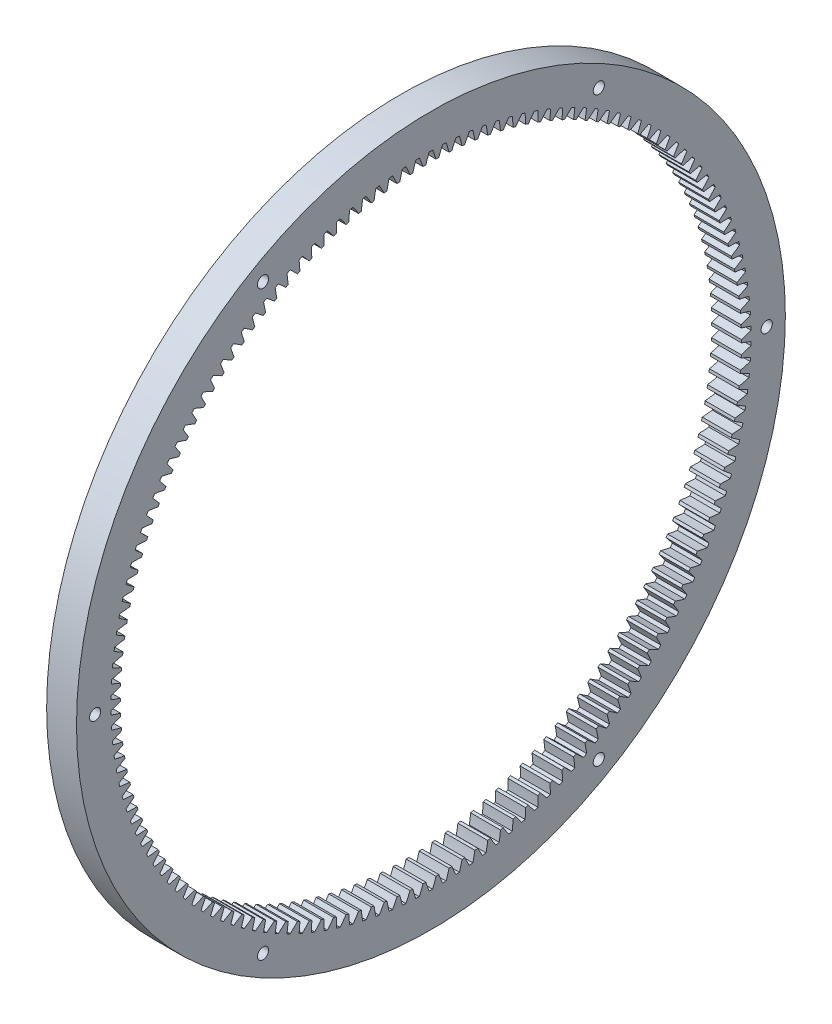
from build123d import *

# Parameters (mm, degrees)
ESBO_O1_R                = 95
ESBO_O1_R_2              = 1.5
RESSALTO_EXTRUS_O1_DEPTH = 8


with BuildPart() as part:
    # Esboço1 → Ressalto-extrusão1 (new body)
    with BuildSketch(Plane(origin=(12, 0, 0), x_dir=(0, 0, -1), z_dir=(1, 0, 0))):
        with Locations(Location((0, 0, 0), (0, 0, 180))):
            Circle(ESBO_O1_R)
        with Locations(Location((-45, 77.942286341, 0), (0, 0, 180))):
            Circle(ESBO_O1_R_2, mode=Mode.SUBTRACT)
        with Locations(Location((-90, 0, 0), (0, 0, 180))):
            Circle(ESBO_O1_R_2, mode=Mode.SUBTRACT)
        with Locations(Location((-45, -77.942286341, 0), (0, 0, 180))):
            Circle(ESBO_O1_R_2, mode=Mode.SUBTRACT)
        with Locations(Location((45, -77.942286341, 0), (0, 0, 180))):
            Circle(ESBO_O1_R_2, mode=Mode.SUBTRACT)
        with Locations(Location((90, 0, 0), (0, 0, 180))):
            Circle(ESBO_O1_R_2, mode=Mode.SUBTRACT)
        with Locations(Location((45, 77.942286341, 0), (0, 0, 180))):
            Circle(ESBO_O1_R_2, mode=Mode.SUBTRACT)
        with BuildLine():
            ThreePointArc((2.124504253, 83.222887367), (2.602984617, 84.482122975), (3.12142424, 85.725440365))
            ThreePointArc((3.12142424, 85.725440365), (3.592187797, 85.707004392), (4.062843003, 85.685983228))
            ThreePointArc((4.062843003, 85.685983228), (4.475426267, 84.403644418), (4.846858413, 83.108786921))
            ThreePointArc((4.846858413, 83.108786921), (5.227310751, 83.085725142), (5.607653516, 83.060921751))
            ThreePointArc((5.607653516, 83.060921751), (6.138445485, 84.299016117), (6.708495077, 85.519532908))
            ThreePointArc((6.708495077, 85.519532908), (7.178073676, 85.481399575), (7.647435762, 85.440687856))
            ThreePointArc((7.647435762, 85.440687856), (8.005958345, 84.142196681), (8.322841678, 82.83292103))
            ThreePointArc((8.322841678, 82.83292103), (8.701994567, 82.793947789), (9.080965049, 82.753239053))
            ThreePointArc((9.080965049, 82.753239053), (9.663137434, 83.96802014), (10.283796934, 85.163595131))
            ThreePointArc((10.283796934, 85.163595131), (10.751366775, 85.105831337), (11.218612321, 85.045500484))
            ThreePointArc((11.218612321, 85.045500484), (11.522445252, 83.733134939), (11.78422385, 82.411738049))
            ThreePointArc((11.78422385, 82.411738049), (12.161412128, 82.356921719), (12.538345483, 82.300379055))
            ThreePointArc((12.538345483, 82.300379055), (13.170876956, 83.489715723), (13.841057517, 84.658251469))
            ThreePointArc((13.841057517, 84.658251469), (14.305798323, 84.580958551), (14.770107621, 84.501114406))
            ThreePointArc((14.770107621, 84.501114406), (15.018717874, 83.177176826), (15.224932489, 81.845976875))
            ThreePointArc((15.224932489, 81.845976875), (15.599494439, 81.775413623), (15.973729399, 81.703136226))
            ThreePointArc((15.973729399, 81.703136226), (16.655510285, 82.864941974), (17.374036182, 84.004388468))
            ThreePointArc((17.374036182, 84.004388468), (17.83513264, 83.907702023), (18.295691134, 83.80848466))
            ThreePointArc((18.295691134, 83.80848466), (18.488642562, 82.475297681), (18.638931423, 81.136630047))
            ThreePointArc((18.638931423, 81.136630047), (19.010209937, 81.050443664), (19.381089965, 80.962558333))
            ThreePointArc((19.381089965, 80.962558333), (20.110924189, 82.09479496), (20.876534884, 83.203153223))
            ThreePointArc((20.876534884, 83.203153223), (21.333178073, 83.087242874), (21.789177788, 82.968826353))
            ThreePointArc((21.789177788, 82.968826353), (21.926131888, 81.628728838), (22.020231338, 80.284941999))
            ThreePointArc((22.020231338, 80.284941999), (22.387575066, 80.183283686), (22.754449514, 80.079944601))
            ThreePointArc((22.754449514, 80.079944601), (23.531056698, 81.180625779), (24.342409049, 82.255951376))
            ThreePointArc((24.342409049, 82.255951376), (24.793797863, 82.121020467), (25.244438819, 81.983612532))
            ThreePointArc((25.244438819, 81.983612532), (25.325155328, 80.638955468), (25.362900285, 79.292406882))
            ThreePointArc((25.362900285, 79.292406882), (25.725664782, 79.175454982), (26.087890027, 79.056843435))
            ThreePointArc((26.087890027, 79.056843435), (26.909907738, 80.124038196), (27.765578357, 81.164444639))
            ThreePointArc((27.765578357, 81.164444639), (28.210920907, 81.010729886), (28.655412527, 80.854571596))
            ThreePointArc((28.655412527, 80.854571596), (28.67974984, 79.507713968), (28.661074086, 78.160765939))
            ThreePointArc((28.661074086, 78.160765939), (29.01862294, 78.028725625), (29.375563515, 77.895049702))
            ThreePointArc((29.375563515, 77.895049702), (30.241549656, 78.926885823), (31.140037407, 79.930547886))
            ThreePointArc((31.140037407, 79.930547886), (31.57855241, 79.758318957), (32.016114905, 79.583684267))
            ThreePointArc((32.016114905, 79.583684267), (31.984030326, 78.236988921), (31.908966624, 76.892004454))
            ThreePointArc((31.908966624, 76.892004454), (32.260672572, 76.74510737), (32.611702284, 76.596601584))
            ThreePointArc((32.611702284, 76.596601584), (33.52013762, 77.591268872), (34.459866249, 78.556425792))
            ThreePointArc((34.459866249, 78.556425792), (34.8907844, 78.365984834), (35.320650137, 78.173180113))
            ThreePointArc((35.320650137, 78.173180113), (35.232199954, 76.82900961), (35.100879992, 75.488348265))
            ThreePointArc((35.100879992, 75.488348265), (35.446126023, 75.326852118), (35.790629045, 75.163776998))
            ThreePointArc((35.790629045, 75.163776998), (36.739919872, 76.119530471), (37.719240776, 77.044489033))
            ThreePointArc((37.719240776, 77.044489033), (38.1418061, 76.836170145), (38.563220947, 76.625533638))
            ThreePointArc((38.563220947, 76.625533638), (38.418560331, 75.28624611), (38.231214489, 73.952259862))
            ThreePointArc((38.231214489, 73.952259862), (38.569394924, 73.776447971), (38.906766881, 73.599089606))
            ThreePointArc((38.906766881, 73.599089606), (39.89524782, 74.514252547), (40.912442938, 75.39739006))
            ThreePointArc((40.912442938, 75.39739006), (41.32591411, 75.171558704), (41.738138764, 74.943459939))
            ThreePointArc((41.738138764, 74.943459939), (41.537521499, 73.611404952), (41.294478445, 72.286434066))
            ThreePointArc((41.294478445, 72.286434066), (41.625, 72.096614865), (41.954649027, 71.905284402))
            ThreePointArc((41.954649027, 71.905284402), (42.980585947, 72.778251305), (44.033870773, 73.618018446))
            ThreePointArc((44.033870773, 73.618018446), (44.437522425, 73.375070806), (44.839833702, 73.129909945))
            ThreePointArc((44.839833702, 73.129909945), (44.58361174, 71.807424376), (44.285297854, 70.493793301))
            ThreePointArc((44.285297854, 70.493793301), (44.607580682, 70.290299798), (44.928928463, 70.085332896))
            ThreePointArc((44.928928463, 70.085332896), (45.990521521, 70.914572279), (47.078048235, 71.709495811))
            ThreePointArc((47.078048235, 71.709495811), (47.471172225, 71.449858101), (47.862864336, 71.18806524))
            ThreePointArc((47.862864336, 71.18806524), (47.551487176, 69.877469177), (47.198425802, 68.577482469))
            ThreePointArc((47.198425802, 68.577482469), (47.51190451, 68.36067166), (47.824387291, 68.142427901))
            ThreePointArc((47.824387291, 68.142427901), (48.919774093, 68.926484997), (50.039634804, 69.675170353))
            ThreePointArc((50.039634804, 69.675170353), (50.421541458, 69.399298066), (50.801927242, 69.121332478))
            ThreePointArc((50.801927242, 69.121332478), (50.435941146, 67.824925153), (50.028751673, 66.54086343))
            ThreePointArc((50.028751673, 66.54086343), (50.332876312, 66.311115676), (50.635945893, 66.079977932))
            ThreePointArc((50.635945893, 66.079977932), (51.763204758, 66.817477238), (52.91343485, 67.518610971))
            ThreePointArc((52.91343485, 67.518610971), (53.283454175, 67.22698808), (53.651866304, 66.933337412))
            ThreePointArc((53.651866304, 66.933337412), (53.231913336, 65.653393163), (52.771310114, 64.387509106))
            ThreePointArc((52.771310114, 64.387509106), (53.065547147, 64.145227461), (53.35867184, 63.901601228))
            ThreePointArc((53.35867184, 63.901601228), (54.515825173, 64.59124892), (55.69440675, 65.243601003))
            ThreePointArc((55.69440675, 65.243601003), (56.051889607, 64.936739113), (56.407681763, 64.627918528))
            ThreePointArc((56.407681763, 64.627918528), (55.934498662, 63.366682813), (55.421289745, 62.121197212))
            ThreePointArc((55.421289745, 62.121197212), (55.705122979, 61.866806721), (55.987788544, 61.611119401))
            ThreePointArc((55.987788544, 61.611119401), (57.172806305, 62.251705603), (58.377671737, 62.854131588))
            ThreePointArc((58.377671737, 62.854131588), (58.721990978, 62.53256904), (59.064538979, 62.209120314))
            ThreePointArc((59.064538979, 62.209120314), (58.538955871, 60.968805768), (57.974041601, 59.745903629))
            ThreePointArc((57.974041601, 59.745903629), (58.246973098, 59.479850579), (58.518683643, 59.212550736))
            ThreePointArc((58.518683643, 59.212550736), (59.729486908, 59.802951641), (60.95852245, 60.354394668))
            ThreePointArc((60.95852245, 60.354394668), (61.289074022, 60.018695592), (61.617776925, 59.681186164))
            ThreePointArc((61.617776925, 59.681186164), (61.040715859, 58.463968721), (60.425087289, 57.265795429))
            ThreePointArc((60.425087289, 57.265795429), (60.686638233, 56.988546569), (60.946917087, 56.710103136))
            ThreePointArc((60.946917087, 56.710103136), (62.181381695, 57.24928298), (63.432431201, 57.748775632))
            ThreePointArc((63.432431201, 57.748775632), (63.748635205, 57.399528957), (64.062916351, 57.048550934))
            ThreePointArc((64.062916351, 57.048550934), (63.43538969, 55.856566007), (62.770126841, 54.685223565))
            ThreePointArc((62.770126841, 54.685223565), (63.019838383, 54.397265282), (63.268228927, 54.108166744))
            ThreePointArc((63.268228927, 54.108166744), (64.524189209, 54.595179624), (65.795057913, 55.04184562))
            ThreePointArc((65.795057913, 55.04184562), (66.09635962, 54.679664045), (66.395667654, 54.31583316))
            ThreePointArc((66.395667654, 54.31583316), (65.718776293, 53.151171896), (65.005046261, 52.008715237))
            ThreePointArc((65.005046261, 52.008715237), (65.242480322, 51.710552708), (65.478546796, 51.411306242))
            ThreePointArc((65.478546796, 51.411306242), (66.75379937, 51.845297771), (68.042257737, 52.238353507))
            ThreePointArc((68.042257737, 52.238353507), (68.32812856, 51.863872421), (68.611938394, 51.487826958))
            ThreePointArc((68.611938394, 51.487826958), (67.88686983, 50.352532568), (67.125924741, 49.240965949))
            ThreePointArc((67.125924741, 49.240965949), (67.350664782, 48.933122253), (67.573993043, 48.62425284))
            ThreePointArc((67.573993043, 48.62425284), (68.866300683, 49.004461649), (70.170088319, 49.343217572))
            ThreePointArc((70.170088319, 49.343217572), (70.440026745, 48.957093941), (70.70784048, 48.569493612))
            ThreePointArc((70.70784048, 48.569493612), (69.935866729, 47.465557788), (69.12904154, 46.386831276))
            ThreePointArc((69.12904154, 46.386831276), (69.340693289, 46.069846475), (69.550891545, 45.751895975))
            ThreePointArc((69.550891545, 45.751895975), (70.857987104, 46.077655049), (72.174816723, 46.361516866))
            ThreePointArc((72.174816723, 46.361516866), (72.428349187, 45.964428084), (72.679696987, 45.56595287))
            ThreePointArc((72.679696987, 45.56595287), (71.862172354, 44.495312291), (71.010882509, 43.451318337))
            ThreePointArc((71.010882509, 43.451318337), (71.209074658, 43.12574853), (71.40577415, 42.799274738))
            ThreePointArc((71.40577415, 42.799274738), (72.725364538, 43.070012585), (74.052925972, 43.298482306))
            ThreePointArc((74.052925972, 43.298482306), (74.289607694, 42.891125), (74.524048608, 42.482473964))
            ThreePointArc((74.524048608, 42.482473964), (73.662407309, 41.447006897), (72.768146261, 40.439577022))
            ThreePointArc((72.768146261, 40.439577022), (72.952531114, 40.105993369), (73.135386763, 39.77156903))
            ThreePointArc((73.135386763, 39.77156903), (74.46515697, 39.986810684), (75.801121227, 40.159487495))
            ThreePointArc((75.801121227, 40.159487495), (76.020536984, 39.742576309), (76.237659725, 39.324466362))
            ThreePointArc((76.237659725, 39.324466362), (75.333413372, 38.325989369), (74.397749958, 37.356890946))
            ThreePointArc((74.397749958, 37.356890946), (74.56800404, 37.015878667), (74.736695056, 36.674090475))
            ThreePointArc((74.736695056, 36.674090475), (76.074312214, 36.833458329), (77.416335557, 36.950039296))
            ThreePointArc((77.416335557, 36.950039296), (77.618100421, 36.524305634), (77.817524081, 36.097470284))
            ThreePointArc((77.817524081, 36.097470284), (76.872259028, 35.137735032), (75.896834721, 34.208668191))
            ThreePointArc((75.896834721, 34.208668191), (76.052659349, 33.860825536), (76.20688979, 33.512273104))
            ThreePointArc((76.20688979, 33.512273104), (77.550007264, 33.615487572), (78.895735328, 33.675768173))
            ThreePointArc((78.895735328, 33.675768173), (79.079495335, 33.241958916), (79.260870058, 32.807146977))
            ThreePointArc((79.260870058, 32.807146977), (78.276244622, 31.887837168), (77.262770645, 31.000431807))
            ThreePointArc((77.262770645, 31.000431807), (77.40389245, 30.646369011), (77.543391744, 30.291663818))
            ThreePointArc((77.543391744, 30.291663818), (78.889653249, 30.338543827), (80.236725171, 30.34241831))
            ThreePointArc((80.236725171, 30.34241831), (80.402157943, 29.901294506), (80.565165535, 29.459268787))
            ThreePointArc((80.565165535, 29.459268787), (79.542907083, 28.581997202), (78.493161416, 27.737810131))
            ThreePointArc((78.493161416, 27.737810131), (78.619332822, 27.378148341), (78.74385624, 27.01791266))
            ThreePointArc((78.74385624, 27.01791266), (80.090899976, 27.008375967), (81.436952533, 26.955837534))
            ThreePointArc((81.436952533, 26.955837534), (81.583767845, 26.508173066), (81.728122335, 26.059709028))
            ThreePointArc((81.728122335, 26.059709028), (80.670024257, 25.2260147), (79.58584851, 24.426526911))
            ThreePointArc((79.58584851, 24.426526911), (79.69684817, 24.061897096), (79.806177254, 23.696762903))
            ThreePointArc((79.806177254, 23.696762903), (81.151640049, 23.630826239), (82.494311808, 23.52196706))
            ThreePointArc((82.494311808, 23.52196706), (82.622252096, 23.068547282), (82.747700238, 22.614431685))
            ThreePointArc((82.747700238, 22.614431685), (81.655618796, 21.825777197), (80.538914982, 21.072391263))
            ThreePointArc((80.538914982, 21.072391263), (80.634548164, 20.703433106), (80.728491115, 20.334040972))
            ThreePointArc((80.728491115, 20.334040972), (82.070012569, 20.211820011), (83.406948028, 20.046831062))
            ThreePointArc((83.406948028, 20.046831062), (83.515788841, 19.588451428), (83.622110556, 19.129480944))
            ThreePointArc((83.622110556, 19.129480944), (82.497961634, 18.387249865), (81.350688829, 17.68128748))
            ThreePointArc((81.350688829, 17.68128748), (81.430787761, 17.308648261), (81.509179771, 16.935646223))
            ThreePointArc((81.509179771, 16.935646223), (82.844406401, 16.757355383), (84.17326012, 16.536526111))
            ThreePointArc((84.17326012, 16.536526111), (84.262810514, 16.073990773), (84.349819278, 15.610970593))
            ThreePointArc((84.349819278, 15.610970593), (83.195575013, 14.916465048), (82.019745926, 14.259164711))
            ThreePointArc((82.019745926, 14.259164711), (82.084170086, 13.883498164), (82.146873629, 13.507540596))
            ThreePointArc((82.146873629, 13.507540596), (83.473462992, 13.273492659), (84.791903711, 12.997210474))
            ThreePointArc((84.791903711, 12.997210474), (84.862006584, 12.531330877), (84.929549754, 12.065073296))
            ThreePointArc((84.929549754, 12.065073296), (83.747235084, 11.419511683), (82.544912517, 10.812026522))
            ThreePointArc((82.544912517, 10.812026522), (82.593548884, 10.433991694), (82.640453957, 10.055738153))
            ThreePointArc((82.640453957, 10.055738153), (83.956078765, 9.766343719), (85.261793491, 9.435093313))
            ThreePointArc((85.261793491, 9.435093313), (85.312325859, 8.966686768), (85.360284941, 8.49800976))
            ThreePointArc((85.360284941, 8.49800976), (84.151974047, 7.902524614), (82.925267283, 7.345920364))
            ThreePointArc((82.925267283, 7.345920364), (82.958030533, 6.966180457), (82.989054847, 6.586294529))
            ThreePointArc((82.989054847, 6.586294529), (84.291407048, 6.242061294), (85.582105112, 5.856423793))
            ThreePointArc((85.582105112, 5.856423793), (85.612978325, 5.386312044), (85.641269182, 4.916037827))
            ThreePointArc((85.641269182, 4.916037827), (84.409081853, 4.371673831), (83.160142952, 3.866926965))
            ThreePointArc((83.160142952, 3.866926965), (83.176975606, 3.486148173), (83.192064735, 3.105296305))
            ThreePointArc((83.192064735, 3.105296305), (84.47885956, 2.706828171), (85.75227664, 2.267480115))
            ThreePointArc((85.75227664, 2.267480115), (85.763436535, 1.796487898), (85.772009536, 1.325441493))
            ThreePointArc((85.772009536, 1.325441493), (84.518107446, 0.833153647), (83.249127472, 0.381149663))
            ThreePointArc((83.249127472, 0.381149663), (83.25, 0), (83.249127472, -0.381149663))
            ThreePointArc((83.249127472, -0.381149663), (84.518107446, -0.833153647), (85.772009536, -1.325441493))
            ThreePointArc((85.772009536, -1.325441493), (85.763436535, -1.796487898), (85.75227664, -2.267480115))
            ThreePointArc((85.75227664, -2.267480115), (84.47885956, -2.706828171), (83.192064735, -3.105296305))
            ThreePointArc((83.192064735, -3.105296305), (83.176975606, -3.486148173), (83.160142952, -3.866926965))
            ThreePointArc((83.160142952, -3.866926965), (84.409081853, -4.371673831), (85.641269182, -4.916037827))
            ThreePointArc((85.641269182, -4.916037827), (85.612978325, -5.386312044), (85.582105112, -5.856423793))
            ThreePointArc((85.582105112, -5.856423793), (84.291407048, -6.242061294), (82.989054847, -6.586294529))
            ThreePointArc((82.989054847, -6.586294529), (82.958030533, -6.966180457), (82.925267283, -7.345920364))
            ThreePointArc((82.925267283, -7.345920364), (84.151974047, -7.902524614), (85.360284941, -8.49800976))
            ThreePointArc((85.360284941, -8.49800976), (85.312325859, -8.966686768), (85.261793491, -9.435093313))
            ThreePointArc((85.261793491, -9.435093313), (83.956078765, -9.766343719), (82.640453957, -10.055738153))
            ThreePointArc((82.640453957, -10.055738153), (82.593548884, -10.433991694), (82.544912517, -10.812026522))
            ThreePointArc((82.544912517, -10.812026522), (83.747235084, -11.419511683), (84.929549754, -12.065073296))
            ThreePointArc((84.929549754, -12.065073296), (84.862006584, -12.531330877), (84.791903711, -12.997210474))
            ThreePointArc((84.791903711, -12.997210474), (83.473462992, -13.273492659), (82.146873629, -13.507540596))
            ThreePointArc((82.146873629, -13.507540596), (82.084170086, -13.883498164), (82.019745926, -14.259164711))
            ThreePointArc((82.019745926, -14.259164711), (83.195575013, -14.916465048), (84.349819278, -15.610970593))
            ThreePointArc((84.349819278, -15.610970593), (84.262810514, -16.073990773), (84.17326012, -16.536526111))
            ThreePointArc((84.17326012, -16.536526111), (82.844406401, -16.757355383), (81.509179771, -16.935646223))
            ThreePointArc((81.509179771, -16.935646223), (81.430787761, -17.308648261), (81.350688829, -17.68128748))
            ThreePointArc((81.350688829, -17.68128748), (82.497961634, -18.387249865), (83.622110556, -19.129480944))
            ThreePointArc((83.622110556, -19.129480944), (83.515788841, -19.588451428), (83.406948028, -20.046831062))
            ThreePointArc((83.406948028, -20.046831062), (82.070012569, -20.211820011), (80.728491115, -20.334040972))
            ThreePointArc((80.728491115, -20.334040972), (80.634548164, -20.703433106), (80.538914982, -21.072391263))
            ThreePointArc((80.538914982, -21.072391263), (81.655618796, -21.825777197), (82.747700238, -22.614431685))
            ThreePointArc((82.747700238, -22.614431685), (82.622252096, -23.068547282), (82.494311808, -23.52196706))
            ThreePointArc((82.494311808, -23.52196706), (81.151640049, -23.630826239), (79.806177254, -23.696762903))
            ThreePointArc((79.806177254, -23.696762903), (79.69684817, -24.061897096), (79.58584851, -24.426526911))
            ThreePointArc((79.58584851, -24.426526911), (80.670024257, -25.2260147), (81.728122335, -26.059709028))
            ThreePointArc((81.728122335, -26.059709028), (81.583767845, -26.508173066), (81.436952533, -26.955837534))
            ThreePointArc((81.436952533, -26.955837534), (80.090899976, -27.008375967), (78.74385624, -27.01791266))
            ThreePointArc((78.74385624, -27.01791266), (78.619332822, -27.378148341), (78.493161416, -27.737810131))
            ThreePointArc((78.493161416, -27.737810131), (79.542907083, -28.581997202), (80.565165535, -29.459268787))
            ThreePointArc((80.565165535, -29.459268787), (80.402157943, -29.901294506), (80.236725171, -30.34241831))
            ThreePointArc((80.236725171, -30.34241831), (78.889653249, -30.338543827), (77.543391744, -30.291663818))
            ThreePointArc((77.543391744, -30.291663818), (77.40389245, -30.646369011), (77.262770645, -31.000431807))
            ThreePointArc((77.262770645, -31.000431807), (78.276244622, -31.887837168), (79.260870058, -32.807146977))
            ThreePointArc((79.260870058, -32.807146977), (79.079495335, -33.241958916), (78.895735328, -33.675768173))
            ThreePointArc((78.895735328, -33.675768173), (77.550007264, -33.615487572), (76.20688979, -33.512273104))
            ThreePointArc((76.20688979, -33.512273104), (76.052659349, -33.860825536), (75.896834721, -34.208668191))
            ThreePointArc((75.896834721, -34.208668191), (76.872259028, -35.137735032), (77.817524081, -36.097470284))
            ThreePointArc((77.817524081, -36.097470284), (77.618100421, -36.524305634), (77.416335557, -36.950039296))
            ThreePointArc((77.416335557, -36.950039296), (76.074312214, -36.833458329), (74.736695056, -36.674090475))
            ThreePointArc((74.736695056, -36.674090475), (74.56800404, -37.015878667), (74.397749958, -37.356890946))
            ThreePointArc((74.397749958, -37.356890946), (75.333413372, -38.325989369), (76.237659725, -39.324466362))
            ThreePointArc((76.237659725, -39.324466362), (76.020536984, -39.742576309), (75.801121227, -40.159487495))
            ThreePointArc((75.801121227, -40.159487495), (74.46515697, -39.986810684), (73.135386763, -39.77156903))
            ThreePointArc((73.135386763, -39.77156903), (72.952531114, -40.105993369), (72.768146261, -40.439577022))
            ThreePointArc((72.768146261, -40.439577022), (73.662407309, -41.447006897), (74.524048608, -42.482473964))
            ThreePointArc((74.524048608, -42.482473964), (74.289607694, -42.891125), (74.052925972, -43.298482306))
            ThreePointArc((74.052925972, -43.298482306), (72.725364538, -43.070012585), (71.40577415, -42.799274738))
            ThreePointArc((71.40577415, -42.799274738), (71.209074658, -43.12574853), (71.010882509, -43.451318337))
            ThreePointArc((71.010882509, -43.451318337), (71.862172354, -44.495312291), (72.679696987, -45.56595287))
            ThreePointArc((72.679696987, -45.56595287), (72.428349187, -45.964428084), (72.174816723, -46.361516866))
            ThreePointArc((72.174816723, -46.361516866), (70.857987104, -46.077655049), (69.550891545, -45.751895975))
            ThreePointArc((69.550891545, -45.751895975), (69.340693289, -46.069846475), (69.12904154, -46.386831276))
            ThreePointArc((69.12904154, -46.386831276), (69.935866729, -47.465557788), (70.70784048, -48.569493612))
            ThreePointArc((70.70784048, -48.569493612), (70.440026745, -48.957093941), (70.170088319, -49.343217572))
            ThreePointArc((70.170088319, -49.343217572), (68.866300683, -49.004461649), (67.573993043, -48.62425284))
            ThreePointArc((67.573993043, -48.62425284), (67.350664782, -48.933122253), (67.125924741, -49.240965949))
            ThreePointArc((67.125924741, -49.240965949), (67.88686983, -50.352532568), (68.611938394, -51.487826958))
            ThreePointArc((68.611938394, -51.487826958), (68.32812856, -51.863872421), (68.042257737, -52.238353507))
            ThreePointArc((68.042257737, -52.238353507), (66.75379937, -51.845297771), (65.478546796, -51.411306242))
            ThreePointArc((65.478546796, -51.411306242), (65.242480322, -51.710552708), (65.005046261, -52.008715237))
            ThreePointArc((65.005046261, -52.008715237), (65.718776293, -53.151171896), (66.395667654, -54.31583316))
            ThreePointArc((66.395667654, -54.31583316), (66.09635962, -54.679664045), (65.795057913, -55.04184562))
            ThreePointArc((65.795057913, -55.04184562), (64.524189209, -54.595179624), (63.268228927, -54.108166744))
            ThreePointArc((63.268228927, -54.108166744), (63.019838383, -54.397265282), (62.770126841, -54.685223565))
            ThreePointArc((62.770126841, -54.685223565), (63.43538969, -55.856566007), (64.062916351, -57.048550934))
            ThreePointArc((64.062916351, -57.048550934), (63.748635205, -57.399528957), (63.432431201, -57.748775632))
            ThreePointArc((63.432431201, -57.748775632), (62.181381695, -57.24928298), (60.946917087, -56.710103136))
            ThreePointArc((60.946917087, -56.710103136), (60.686638233, -56.988546569), (60.425087289, -57.265795429))
            ThreePointArc((60.425087289, -57.265795429), (61.040715859, -58.463968721), (61.617776925, -59.681186164))
            ThreePointArc((61.617776925, -59.681186164), (61.289074022, -60.018695592), (60.95852245, -60.354394668))
            ThreePointArc((60.95852245, -60.354394668), (59.729486908, -59.802951641), (58.518683643, -59.212550736))
            ThreePointArc((58.518683643, -59.212550736), (58.246973098, -59.479850579), (57.974041601, -59.745903629))
            ThreePointArc((57.974041601, -59.745903629), (58.538955871, -60.968805768), (59.064538979, -62.209120314))
            ThreePointArc((59.064538979, -62.209120314), (58.721990978, -62.53256904), (58.377671737, -62.854131588))
            ThreePointArc((58.377671737, -62.854131588), (57.172806305, -62.251705603), (55.987788544, -61.611119401))
            ThreePointArc((55.987788544, -61.611119401), (55.705122979, -61.866806721), (55.421289745, -62.121197212))
            ThreePointArc((55.421289745, -62.121197212), (55.934498662, -63.366682813), (56.407681763, -64.627918528))
            ThreePointArc((56.407681763, -64.627918528), (56.051889607, -64.936739113), (55.69440675, -65.243601003))
            ThreePointArc((55.69440675, -65.243601003), (54.515825173, -64.59124892), (53.35867184, -63.901601228))
            ThreePointArc((53.35867184, -63.901601228), (53.065547147, -64.145227461), (52.771310114, -64.387509106))
            ThreePointArc((52.771310114, -64.387509106), (53.231913336, -65.653393163), (53.651866304, -66.933337412))
            ThreePointArc((53.651866304, -66.933337412), (53.283454175, -67.22698808), (52.91343485, -67.518610971))
            ThreePointArc((52.91343485, -67.518610971), (51.763204758, -66.817477238), (50.635945893, -66.079977932))
            ThreePointArc((50.635945893, -66.079977932), (50.332876312, -66.311115676), (50.028751673, -66.54086343))
            ThreePointArc((50.028751673, -66.54086343), (50.435941146, -67.824925153), (50.801927242, -69.121332478))
            ThreePointArc((50.801927242, -69.121332478), (50.421541458, -69.399298066), (50.039634804, -69.675170353))
            ThreePointArc((50.039634804, -69.675170353), (48.919774093, -68.926484997), (47.824387291, -68.142427901))
            ThreePointArc((47.824387291, -68.142427901), (47.51190451, -68.36067166), (47.198425802, -68.577482469))
            ThreePointArc((47.198425802, -68.577482469), (47.551487176, -69.877469177), (47.862864336, -71.18806524))
            ThreePointArc((47.862864336, -71.18806524), (47.471172225, -71.449858101), (47.078048235, -71.709495811))
            ThreePointArc((47.078048235, -71.709495811), (45.990521521, -70.914572279), (44.928928463, -70.085332896))
            ThreePointArc((44.928928463, -70.085332896), (44.607580682, -70.290299798), (44.285297854, -70.493793301))
            ThreePointArc((44.285297854, -70.493793301), (44.58361174, -71.807424376), (44.839833702, -73.129909945))
            ThreePointArc((44.839833702, -73.129909945), (44.437522425, -73.375070806), (44.033870773, -73.618018446))
            ThreePointArc((44.033870773, -73.618018446), (42.980585947, -72.778251305), (41.954649027, -71.905284402))
            ThreePointArc((41.954649027, -71.905284402), (41.625, -72.096614865), (41.294478445, -72.286434066))
            ThreePointArc((41.294478445, -72.286434066), (41.537521499, -73.611404952), (41.738138764, -74.943459939))
            ThreePointArc((41.738138764, -74.943459939), (41.32591411, -75.171558704), (40.912442938, -75.39739006))
            ThreePointArc((40.912442938, -75.39739006), (39.89524782, -74.514252547), (38.906766881, -73.599089606))
            ThreePointArc((38.906766881, -73.599089606), (38.569394924, -73.776447971), (38.231214489, -73.952259862))
            ThreePointArc((38.231214489, -73.952259862), (38.418560331, -75.28624611), (38.563220947, -76.625533638))
            ThreePointArc((38.563220947, -76.625533638), (38.1418061, -76.836170145), (37.719240776, -77.044489033))
            ThreePointArc((37.719240776, -77.044489033), (36.739919872, -76.119530471), (35.790629045, -75.163776998))
            ThreePointArc((35.790629045, -75.163776998), (35.446126023, -75.326852118), (35.100879992, -75.488348265))
            ThreePointArc((35.100879992, -75.488348265), (35.232199954, -76.82900961), (35.320650137, -78.173180113))
            ThreePointArc((35.320650137, -78.173180113), (34.8907844, -78.365984834), (34.459866249, -78.556425792))
            ThreePointArc((34.459866249, -78.556425792), (33.52013762, -77.591268872), (32.611702284, -76.596601584))
            ThreePointArc((32.611702284, -76.596601584), (32.260672572, -76.74510737), (31.908966624, -76.892004454))
            ThreePointArc((31.908966624, -76.892004454), (31.984030326, -78.236988921), (32.016114905, -79.583684267))
            ThreePointArc((32.016114905, -79.583684267), (31.57855241, -79.758318957), (31.140037407, -79.930547886))
            ThreePointArc((31.140037407, -79.930547886), (30.241549656, -78.926885823), (29.375563515, -77.895049702))
            ThreePointArc((29.375563515, -77.895049702), (29.01862294, -78.028725625), (28.661074086, -78.160765939))
            ThreePointArc((28.661074086, -78.160765939), (28.67974984, -79.507713968), (28.655412527, -80.854571596))
            ThreePointArc((28.655412527, -80.854571596), (28.210920907, -81.010729886), (27.765578357, -81.164444639))
            ThreePointArc((27.765578357, -81.164444639), (26.909907738, -80.124038196), (26.087890027, -79.056843435))
            ThreePointArc((26.087890027, -79.056843435), (25.725664782, -79.175454982), (25.362900285, -79.292406882))
            ThreePointArc((25.362900285, -79.292406882), (25.325155328, -80.638955468), (25.244438819, -81.983612532))
            ThreePointArc((25.244438819, -81.983612532), (24.793797863, -82.121020467), (24.342409049, -82.255951376))
            ThreePointArc((24.342409049, -82.255951376), (23.531056699, -81.180625779), (22.754449514, -80.079944601))
            ThreePointArc((22.754449514, -80.079944601), (22.387575066, -80.183283686), (22.020231338, -80.284941999))
            ThreePointArc((22.020231338, -80.284941999), (21.926131888, -81.628728838), (21.789177788, -82.968826353))
            ThreePointArc((21.789177788, -82.968826353), (21.333178073, -83.087242874), (20.876534884, -83.203153223))
            ThreePointArc((20.876534884, -83.203153223), (20.110924189, -82.09479496), (19.381089965, -80.962558333))
            ThreePointArc((19.381089965, -80.962558333), (19.010209937, -81.050443664), (18.638931423, -81.136630047))
            ThreePointArc((18.638931423, -81.136630047), (18.488642562, -82.475297681), (18.295691134, -83.80848466))
            ThreePointArc((18.295691134, -83.80848466), (17.83513264, -83.907702023), (17.374036182, -84.004388468))
            ThreePointArc((17.374036182, -84.004388468), (16.655510285, -82.864941974), (15.973729399, -81.703136226))
            ThreePointArc((15.973729399, -81.703136226), (15.599494439, -81.775413623), (15.224932489, -81.845976875))
            ThreePointArc((15.224932489, -81.845976875), (15.018717874, -83.177176826), (14.770107621, -84.501114406))
            ThreePointArc((14.770107621, -84.501114406), (14.305798323, -84.580958551), (13.841057517, -84.658251469))
            ThreePointArc((13.841057517, -84.658251469), (13.170876956, -83.489715723), (12.538345483, -82.300379055))
            ThreePointArc((12.538345483, -82.300379055), (12.161412128, -82.356921719), (11.78422385, -82.411738049))
            ThreePointArc((11.78422385, -82.411738049), (11.522445252, -83.733134939), (11.218612321, -85.045500484))
            ThreePointArc((11.218612321, -85.045500484), (10.751366775, -85.105831337), (10.283796934, -85.163595131))
            ThreePointArc((10.283796934, -85.163595131), (9.663137434, -83.96802014), (9.080965049, -82.753239053))
            ThreePointArc((9.080965049, -82.753239053), (8.701994567, -82.793947789), (8.322841678, -82.83292103))
            ThreePointArc((8.322841678, -82.83292103), (8.005958345, -84.142196681), (7.647435762, -85.440687856))
            ThreePointArc((7.647435762, -85.440687856), (7.178073676, -85.481399575), (6.708495077, -85.519532908))
            ThreePointArc((6.708495077, -85.519532908), (6.138445485, -84.299016117), (5.607653516, -83.060921751))
            ThreePointArc((5.607653516, -83.060921751), (5.227310751, -83.085725142), (4.846858413, -83.108786921))
            ThreePointArc((4.846858413, -83.108786921), (4.475426267, -84.403644418), (4.062843003, -85.685983228))
            ThreePointArc((4.062843003, -85.685983228), (3.592187797, -85.707004392), (3.12142424, -85.725440365))
            ThreePointArc((3.12142424, -85.725440365), (2.602984617, -84.482122975), (2.124504253, -83.222887367))
            ThreePointArc((2.124504253, -83.222887367), (1.743456455, -83.231741899), (1.362372112, -83.238851759))
            ThreePointArc((1.362372112, -83.238851759), (0.937042771, -84.517019482), (0.471122636, -85.78095627))
            ThreePointArc((0.471122636, -85.78095627), (0, -85.78225), (-0.471122636, -85.78095627))
            ThreePointArc((-0.471122636, -85.78095627), (-0.937042771, -84.517019482), (-1.362372112, -83.238851759))
            ThreePointArc((-1.362372112, -83.238851759), (-1.743456455, -83.231741899), (-2.124504253, -83.222887367))
            ThreePointArc((-2.124504253, -83.222887367), (-2.602984617, -84.482122975), (-3.12142424, -85.725440365))
            ThreePointArc((-3.12142424, -85.725440365), (-3.592187797, -85.707004392), (-4.062843003, -85.685983228))
            ThreePointArc((-4.062843003, -85.685983228), (-4.475426267, -84.403644418), (-4.846858413, -83.108786921))
            ThreePointArc((-4.846858413, -83.108786921), (-5.227310751, -83.085725142), (-5.607653516, -83.060921751))
            ThreePointArc((-5.607653516, -83.060921751), (-6.138445485, -84.299016117), (-6.708495077, -85.519532908))
            ThreePointArc((-6.708495077, -85.519532908), (-7.178073676, -85.481399575), (-7.647435762, -85.440687856))
            ThreePointArc((-7.647435762, -85.440687856), (-8.005958345, -84.142196681), (-8.322841678, -82.83292103))
            ThreePointArc((-8.322841678, -82.83292103), (-8.701994567, -82.793947789), (-9.080965049, -82.753239053))
            ThreePointArc((-9.080965049, -82.753239053), (-9.663137434, -83.96802014), (-10.283796934, -85.163595131))
            ThreePointArc((-10.283796934, -85.163595131), (-10.751366775, -85.105831337), (-11.218612321, -85.045500484))
            ThreePointArc((-11.218612321, -85.045500484), (-11.522445252, -83.733134939), (-11.78422385, -82.411738049))
            ThreePointArc((-11.78422385, -82.411738049), (-12.161412128, -82.356921719), (-12.538345483, -82.300379055))
            ThreePointArc((-12.538345483, -82.300379055), (-13.170876956, -83.489715723), (-13.841057517, -84.658251469))
            ThreePointArc((-13.841057517, -84.658251469), (-14.305798323, -84.580958551), (-14.770107621, -84.501114406))
            ThreePointArc((-14.770107621, -84.501114406), (-15.018717874, -83.177176826), (-15.224932489, -81.845976875))
            ThreePointArc((-15.224932489, -81.845976875), (-15.599494439, -81.775413623), (-15.973729399, -81.703136226))
            ThreePointArc((-15.973729399, -81.703136226), (-16.655510285, -82.864941974), (-17.374036182, -84.004388468))
            ThreePointArc((-17.374036182, -84.004388468), (-17.83513264, -83.907702023), (-18.295691134, -83.80848466))
            ThreePointArc((-18.295691134, -83.80848466), (-18.488642562, -82.475297681), (-18.638931423, -81.136630047))
            ThreePointArc((-18.638931423, -81.136630047), (-19.010209937, -81.050443664), (-19.381089965, -80.962558333))
            ThreePointArc((-19.381089965, -80.962558333), (-20.110924189, -82.09479496), (-20.876534884, -83.203153223))
            ThreePointArc((-20.876534884, -83.203153223), (-21.333178073, -83.087242874), (-21.789177788, -82.968826353))
            ThreePointArc((-21.789177788, -82.968826353), (-21.926131888, -81.628728838), (-22.020231338, -80.284941999))
            ThreePointArc((-22.020231338, -80.284941999), (-22.387575066, -80.183283686), (-22.754449514, -80.079944601))
            ThreePointArc((-22.754449514, -80.079944601), (-23.531056698, -81.180625779), (-24.342409049, -82.255951376))
            ThreePointArc((-24.342409049, -82.255951376), (-24.793797863, -82.121020467), (-25.244438819, -81.983612532))
            ThreePointArc((-25.244438819, -81.983612532), (-25.325155328, -80.638955468), (-25.362900285, -79.292406882))
            ThreePointArc((-25.362900285, -79.292406882), (-25.725664782, -79.175454982), (-26.087890027, -79.056843435))
            ThreePointArc((-26.087890027, -79.056843435), (-26.909907738, -80.124038196), (-27.765578357, -81.164444639))
            ThreePointArc((-27.765578357, -81.164444639), (-28.210920907, -81.010729886), (-28.655412527, -80.854571596))
            ThreePointArc((-28.655412527, -80.854571596), (-28.67974984, -79.507713968), (-28.661074086, -78.160765939))
            ThreePointArc((-28.661074086, -78.160765939), (-29.01862294, -78.028725625), (-29.375563515, -77.895049702))
            ThreePointArc((-29.375563515, -77.895049702), (-30.241549656, -78.926885823), (-31.140037407, -79.930547886))
            ThreePointArc((-31.140037407, -79.930547886), (-31.57855241, -79.758318957), (-32.016114905, -79.583684267))
            ThreePointArc((-32.016114905, -79.583684267), (-31.984030326, -78.236988921), (-31.908966624, -76.892004454))
            ThreePointArc((-31.908966624, -76.892004454), (-32.260672572, -76.74510737), (-32.611702284, -76.596601584))
            ThreePointArc((-32.611702284, -76.596601584), (-33.52013762, -77.591268872), (-34.459866249, -78.556425792))
            ThreePointArc((-34.459866249, -78.556425792), (-34.8907844, -78.365984834), (-35.320650137, -78.173180113))
            ThreePointArc((-35.320650137, -78.173180113), (-35.232199954, -76.82900961), (-35.100879992, -75.488348265))
            ThreePointArc((-35.100879992, -75.488348265), (-35.446126023, -75.326852118), (-35.790629045, -75.163776998))
            ThreePointArc((-35.790629045, -75.163776998), (-36.739919872, -76.119530471), (-37.719240776, -77.044489033))
            ThreePointArc((-37.719240776, -77.044489033), (-38.1418061, -76.836170145), (-38.563220947, -76.625533638))
            ThreePointArc((-38.563220947, -76.625533638), (-38.418560331, -75.28624611), (-38.231214489, -73.952259862))
            ThreePointArc((-38.231214489, -73.952259862), (-38.569394924, -73.776447971), (-38.906766881, -73.599089606))
            ThreePointArc((-38.906766881, -73.599089606), (-39.89524782, -74.514252547), (-40.912442938, -75.39739006))
            ThreePointArc((-40.912442938, -75.39739006), (-41.32591411, -75.171558704), (-41.738138764, -74.943459939))
            ThreePointArc((-41.738138764, -74.943459939), (-41.537521499, -73.611404952), (-41.294478445, -72.286434066))
            ThreePointArc((-41.294478445, -72.286434066), (-41.625, -72.096614865), (-41.954649027, -71.905284402))
            ThreePointArc((-41.954649027, -71.905284402), (-42.980585947, -72.778251305), (-44.033870773, -73.618018446))
            ThreePointArc((-44.033870773, -73.618018446), (-44.437522425, -73.375070806), (-44.839833702, -73.129909945))
            ThreePointArc((-44.839833702, -73.129909945), (-44.58361174, -71.807424376), (-44.285297854, -70.493793301))
            ThreePointArc((-44.285297854, -70.493793301), (-44.607580682, -70.290299798), (-44.928928463, -70.085332896))
            ThreePointArc((-44.928928463, -70.085332896), (-45.990521521, -70.914572279), (-47.078048235, -71.709495811))
            ThreePointArc((-47.078048235, -71.709495811), (-47.471172225, -71.449858101), (-47.862864336, -71.18806524))
            ThreePointArc((-47.862864336, -71.18806524), (-47.551487176, -69.877469177), (-47.198425802, -68.577482469))
            ThreePointArc((-47.198425802, -68.577482469), (-47.51190451, -68.36067166), (-47.824387291, -68.142427901))
            ThreePointArc((-47.824387291, -68.142427901), (-48.919774093, -68.926484997), (-50.039634804, -69.675170353))
            ThreePointArc((-50.039634804, -69.675170353), (-50.421541458, -69.399298066), (-50.801927242, -69.121332478))
            ThreePointArc((-50.801927242, -69.121332478), (-50.435941146, -67.824925153), (-50.028751673, -66.54086343))
            ThreePointArc((-50.028751673, -66.54086343), (-50.332876312, -66.311115676), (-50.635945893, -66.079977932))
            ThreePointArc((-50.635945893, -66.079977932), (-51.763204758, -66.817477238), (-52.91343485, -67.518610971))
            ThreePointArc((-52.91343485, -67.518610971), (-53.283454175, -67.22698808), (-53.651866304, -66.933337412))
            ThreePointArc((-53.651866304, -66.933337412), (-53.231913336, -65.653393163), (-52.771310114, -64.387509106))
            ThreePointArc((-52.771310114, -64.387509106), (-53.065547147, -64.145227461), (-53.35867184, -63.901601228))
            ThreePointArc((-53.35867184, -63.901601228), (-54.515825173, -64.59124892), (-55.69440675, -65.243601003))
            ThreePointArc((-55.69440675, -65.243601003), (-56.051889607, -64.936739113), (-56.407681763, -64.627918528))
            ThreePointArc((-56.407681763, -64.627918528), (-55.934498662, -63.366682813), (-55.421289745, -62.121197212))
            ThreePointArc((-55.421289745, -62.121197212), (-55.705122979, -61.866806721), (-55.987788544, -61.611119401))
            ThreePointArc((-55.987788544, -61.611119401), (-57.172806305, -62.251705603), (-58.377671737, -62.854131588))
            ThreePointArc((-58.377671737, -62.854131588), (-58.721990978, -62.53256904), (-59.064538979, -62.209120314))
            ThreePointArc((-59.064538979, -62.209120314), (-58.538955871, -60.968805768), (-57.974041601, -59.745903629))
            ThreePointArc((-57.974041601, -59.745903629), (-58.246973098, -59.479850579), (-58.518683643, -59.212550736))
            ThreePointArc((-58.518683643, -59.212550736), (-59.729486908, -59.802951641), (-60.95852245, -60.354394668))
            ThreePointArc((-60.95852245, -60.354394668), (-61.289074022, -60.018695592), (-61.617776925, -59.681186164))
            ThreePointArc((-61.617776925, -59.681186164), (-61.040715859, -58.463968721), (-60.425087289, -57.265795429))
            ThreePointArc((-60.425087289, -57.265795429), (-60.686638233, -56.988546569), (-60.946917087, -56.710103136))
            ThreePointArc((-60.946917087, -56.710103136), (-62.181381695, -57.24928298), (-63.432431201, -57.748775632))
            ThreePointArc((-63.432431201, -57.748775632), (-63.748635205, -57.399528957), (-64.062916351, -57.048550934))
            ThreePointArc((-64.062916351, -57.048550934), (-63.43538969, -55.856566007), (-62.770126841, -54.685223565))
            ThreePointArc((-62.770126841, -54.685223565), (-63.019838383, -54.397265282), (-63.268228927, -54.108166744))
            ThreePointArc((-63.268228927, -54.108166744), (-64.524189209, -54.595179624), (-65.795057913, -55.04184562))
            ThreePointArc((-65.795057913, -55.04184562), (-66.09635962, -54.679664045), (-66.395667654, -54.31583316))
            ThreePointArc((-66.395667654, -54.31583316), (-65.718776293, -53.151171896), (-65.005046261, -52.008715237))
            ThreePointArc((-65.005046261, -52.008715237), (-65.242480322, -51.710552708), (-65.478546796, -51.411306242))
            ThreePointArc((-65.478546796, -51.411306242), (-66.75379937, -51.845297771), (-68.042257737, -52.238353507))
            ThreePointArc((-68.042257737, -52.238353507), (-68.32812856, -51.863872421), (-68.611938394, -51.487826958))
            ThreePointArc((-68.611938394, -51.487826958), (-67.88686983, -50.352532568), (-67.125924741, -49.240965949))
            ThreePointArc((-67.125924741, -49.240965949), (-67.350664782, -48.933122253), (-67.573993043, -48.62425284))
            ThreePointArc((-67.573993043, -48.62425284), (-68.866300683, -49.004461649), (-70.170088319, -49.343217572))
            ThreePointArc((-70.170088319, -49.343217572), (-70.440026745, -48.957093941), (-70.70784048, -48.569493612))
            ThreePointArc((-70.70784048, -48.569493612), (-69.935866729, -47.465557788), (-69.12904154, -46.386831276))
            ThreePointArc((-69.12904154, -46.386831276), (-69.340693289, -46.069846475), (-69.550891545, -45.751895975))
            ThreePointArc((-69.550891545, -45.751895975), (-70.857987104, -46.077655049), (-72.174816723, -46.361516866))
            ThreePointArc((-72.174816723, -46.361516866), (-72.428349187, -45.964428084), (-72.679696987, -45.56595287))
            ThreePointArc((-72.679696987, -45.56595287), (-71.862172354, -44.495312291), (-71.010882509, -43.451318337))
            ThreePointArc((-71.010882509, -43.451318337), (-71.209074658, -43.12574853), (-71.40577415, -42.799274738))
            ThreePointArc((-71.40577415, -42.799274738), (-72.725364538, -43.070012585), (-74.052925972, -43.298482306))
            ThreePointArc((-74.052925972, -43.298482306), (-74.289607694, -42.891125), (-74.524048608, -42.482473964))
            ThreePointArc((-74.524048608, -42.482473964), (-73.662407309, -41.447006897), (-72.768146261, -40.439577022))
            ThreePointArc((-72.768146261, -40.439577022), (-72.952531114, -40.105993369), (-73.135386763, -39.77156903))
            ThreePointArc((-73.135386763, -39.77156903), (-74.46515697, -39.986810684), (-75.801121227, -40.159487495))
            ThreePointArc((-75.801121227, -40.159487495), (-76.020536984, -39.742576309), (-76.237659725, -39.324466362))
            ThreePointArc((-76.237659725, -39.324466362), (-75.333413372, -38.325989369), (-74.397749958, -37.356890946))
            ThreePointArc((-74.397749958, -37.356890946), (-74.56800404, -37.015878667), (-74.736695056, -36.674090475))
            ThreePointArc((-74.736695056, -36.674090475), (-76.074312214, -36.833458329), (-77.416335557, -36.950039296))
            ThreePointArc((-77.416335557, -36.950039296), (-77.618100421, -36.524305634), (-77.817524081, -36.097470284))
            ThreePointArc((-77.817524081, -36.097470284), (-76.872259028, -35.137735032), (-75.896834721, -34.208668191))
            ThreePointArc((-75.896834721, -34.208668191), (-76.052659349, -33.860825536), (-76.20688979, -33.512273104))
            ThreePointArc((-76.20688979, -33.512273104), (-77.550007264, -33.615487572), (-78.895735328, -33.675768173))
            ThreePointArc((-78.895735328, -33.675768173), (-79.079495335, -33.241958916), (-79.260870058, -32.807146977))
            ThreePointArc((-79.260870058, -32.807146977), (-78.276244622, -31.887837168), (-77.262770645, -31.000431807))
            ThreePointArc((-77.262770645, -31.000431807), (-77.40389245, -30.646369011), (-77.543391744, -30.291663818))
            ThreePointArc((-77.543391744, -30.291663818), (-78.889653249, -30.338543827), (-80.236725171, -30.34241831))
            ThreePointArc((-80.236725171, -30.34241831), (-80.402157943, -29.901294506), (-80.565165535, -29.459268787))
            ThreePointArc((-80.565165535, -29.459268787), (-79.542907083, -28.581997202), (-78.493161416, -27.737810131))
            ThreePointArc((-78.493161416, -27.737810131), (-78.619332822, -27.378148341), (-78.74385624, -27.01791266))
            ThreePointArc((-78.74385624, -27.01791266), (-80.090899976, -27.008375967), (-81.436952533, -26.955837534))
            ThreePointArc((-81.436952533, -26.955837534), (-81.583767845, -26.508173066), (-81.728122335, -26.059709028))
            ThreePointArc((-81.728122335, -26.059709028), (-80.670024257, -25.2260147), (-79.58584851, -24.426526911))
            ThreePointArc((-79.58584851, -24.426526911), (-79.69684817, -24.061897096), (-79.806177254, -23.696762903))
            ThreePointArc((-79.806177254, -23.696762903), (-81.151640049, -23.630826239), (-82.494311808, -23.52196706))
            ThreePointArc((-82.494311808, -23.52196706), (-82.622252096, -23.068547282), (-82.747700238, -22.614431685))
            ThreePointArc((-82.747700238, -22.614431685), (-81.655618796, -21.825777197), (-80.538914982, -21.072391263))
            ThreePointArc((-80.538914982, -21.072391263), (-80.634548164, -20.703433106), (-80.728491115, -20.334040972))
            ThreePointArc((-80.728491115, -20.334040972), (-82.070012569, -20.211820011), (-83.406948028, -20.046831062))
            ThreePointArc((-83.406948028, -20.046831062), (-83.515788841, -19.588451428), (-83.622110556, -19.129480944))
            ThreePointArc((-83.622110556, -19.129480944), (-82.497961634, -18.387249865), (-81.350688829, -17.68128748))
            ThreePointArc((-81.350688829, -17.68128748), (-81.430787761, -17.308648261), (-81.509179771, -16.935646223))
            ThreePointArc((-81.509179771, -16.935646223), (-82.844406401, -16.757355383), (-84.17326012, -16.536526111))
            ThreePointArc((-84.17326012, -16.536526111), (-84.262810514, -16.073990773), (-84.349819278, -15.610970593))
            ThreePointArc((-84.349819278, -15.610970593), (-83.195575013, -14.916465048), (-82.019745926, -14.259164711))
            ThreePointArc((-82.019745926, -14.259164711), (-82.084170086, -13.883498164), (-82.146873629, -13.507540596))
            ThreePointArc((-82.146873629, -13.507540596), (-83.473462992, -13.273492659), (-84.791903711, -12.997210474))
            ThreePointArc((-84.791903711, -12.997210474), (-84.862006584, -12.531330877), (-84.929549754, -12.065073296))
            ThreePointArc((-84.929549754, -12.065073296), (-83.747235084, -11.419511683), (-82.544912517, -10.812026522))
            ThreePointArc((-82.544912517, -10.812026522), (-82.593548884, -10.433991694), (-82.640453957, -10.055738153))
            ThreePointArc((-82.640453957, -10.055738153), (-83.956078765, -9.766343719), (-85.261793491, -9.435093313))
            ThreePointArc((-85.261793491, -9.435093313), (-85.312325859, -8.966686768), (-85.360284941, -8.49800976))
            ThreePointArc((-85.360284941, -8.49800976), (-84.151974047, -7.902524614), (-82.925267283, -7.345920364))
            ThreePointArc((-82.925267283, -7.345920364), (-82.958030533, -6.966180457), (-82.989054847, -6.586294529))
            ThreePointArc((-82.989054847, -6.586294529), (-84.291407048, -6.242061294), (-85.582105112, -5.856423793))
            ThreePointArc((-85.582105112, -5.856423793), (-85.612978325, -5.386312044), (-85.641269182, -4.916037827))
            ThreePointArc((-85.641269182, -4.916037827), (-84.409081853, -4.371673831), (-83.160142952, -3.866926965))
            ThreePointArc((-83.160142952, -3.866926965), (-83.176975606, -3.486148173), (-83.192064735, -3.105296305))
            ThreePointArc((-83.192064735, -3.105296305), (-84.47885956, -2.706828171), (-85.75227664, -2.267480115))
            ThreePointArc((-85.75227664, -2.267480115), (-85.763436535, -1.796487898), (-85.772009536, -1.325441493))
            ThreePointArc((-85.772009536, -1.325441493), (-84.518107446, -0.833153647), (-83.249127472, -0.381149663))
            ThreePointArc((-83.249127472, -0.381149663), (-83.25, 0), (-83.249127472, 0.381149663))
            ThreePointArc((-83.249127472, 0.381149663), (-84.518107446, 0.833153647), (-85.772009536, 1.325441493))
            ThreePointArc((-85.772009536, 1.325441493), (-85.763436535, 1.796487898), (-85.75227664, 2.267480115))
            ThreePointArc((-85.75227664, 2.267480115), (-84.47885956, 2.706828171), (-83.192064735, 3.105296305))
            ThreePointArc((-83.192064735, 3.105296305), (-83.176975606, 3.486148173), (-83.160142952, 3.866926965))
            ThreePointArc((-83.160142952, 3.866926965), (-84.409081853, 4.371673831), (-85.641269182, 4.916037827))
            ThreePointArc((-85.641269182, 4.916037827), (-85.612978325, 5.386312044), (-85.582105112, 5.856423793))
            ThreePointArc((-85.582105112, 5.856423793), (-84.291407048, 6.242061294), (-82.989054847, 6.586294529))
            ThreePointArc((-82.989054847, 6.586294529), (-82.958030533, 6.966180457), (-82.925267283, 7.345920364))
            ThreePointArc((-82.925267283, 7.345920364), (-84.151974047, 7.902524614), (-85.360284941, 8.49800976))
            ThreePointArc((-85.360284941, 8.49800976), (-85.312325859, 8.966686768), (-85.261793491, 9.435093313))
            ThreePointArc((-85.261793491, 9.435093313), (-83.956078765, 9.766343719), (-82.640453957, 10.055738153))
            ThreePointArc((-82.640453957, 10.055738153), (-82.593548884, 10.433991694), (-82.544912517, 10.812026522))
            ThreePointArc((-82.544912517, 10.812026522), (-83.747235084, 11.419511683), (-84.929549754, 12.065073296))
            ThreePointArc((-84.929549754, 12.065073296), (-84.862006584, 12.531330877), (-84.791903711, 12.997210474))
            ThreePointArc((-84.791903711, 12.997210474), (-83.473462992, 13.273492659), (-82.146873629, 13.507540596))
            ThreePointArc((-82.146873629, 13.507540596), (-82.084170086, 13.883498164), (-82.019745926, 14.259164711))
            ThreePointArc((-82.019745926, 14.259164711), (-83.195575013, 14.916465048), (-84.349819278, 15.610970593))
            ThreePointArc((-84.349819278, 15.610970593), (-84.262810514, 16.073990773), (-84.17326012, 16.536526111))
            ThreePointArc((-84.17326012, 16.536526111), (-82.844406401, 16.757355383), (-81.509179771, 16.935646223))
            ThreePointArc((-81.509179771, 16.935646223), (-81.430787761, 17.308648261), (-81.350688829, 17.68128748))
            ThreePointArc((-81.350688829, 17.68128748), (-82.497961634, 18.387249865), (-83.622110556, 19.129480944))
            ThreePointArc((-83.622110556, 19.129480944), (-83.515788841, 19.588451428), (-83.406948028, 20.046831062))
            ThreePointArc((-83.406948028, 20.046831062), (-82.070012569, 20.211820011), (-80.728491115, 20.334040972))
            ThreePointArc((-80.728491115, 20.334040972), (-80.634548164, 20.703433106), (-80.538914982, 21.072391263))
            ThreePointArc((-80.538914982, 21.072391263), (-81.655618796, 21.825777197), (-82.747700238, 22.614431685))
            ThreePointArc((-82.747700238, 22.614431685), (-82.622252096, 23.068547282), (-82.494311808, 23.52196706))
            ThreePointArc((-82.494311808, 23.52196706), (-81.151640049, 23.630826239), (-79.806177254, 23.696762903))
            ThreePointArc((-79.806177254, 23.696762903), (-79.69684817, 24.061897096), (-79.58584851, 24.426526911))
            ThreePointArc((-79.58584851, 24.426526911), (-80.670024257, 25.2260147), (-81.728122335, 26.059709028))
            ThreePointArc((-81.728122335, 26.059709028), (-81.583767845, 26.508173066), (-81.436952533, 26.955837534))
            ThreePointArc((-81.436952533, 26.955837534), (-80.090899976, 27.008375967), (-78.74385624, 27.01791266))
            ThreePointArc((-78.74385624, 27.01791266), (-78.619332822, 27.378148341), (-78.493161416, 27.737810131))
            ThreePointArc((-78.493161416, 27.737810131), (-79.542907083, 28.581997202), (-80.565165535, 29.459268787))
            ThreePointArc((-80.565165535, 29.459268787), (-80.402157943, 29.901294506), (-80.236725171, 30.34241831))
            ThreePointArc((-80.236725171, 30.34241831), (-78.889653249, 30.338543827), (-77.543391744, 30.291663818))
            ThreePointArc((-77.543391744, 30.291663818), (-77.40389245, 30.646369011), (-77.262770645, 31.000431807))
            ThreePointArc((-77.262770645, 31.000431807), (-78.276244622, 31.887837168), (-79.260870058, 32.807146977))
            ThreePointArc((-79.260870058, 32.807146977), (-79.079495335, 33.241958916), (-78.895735328, 33.675768173))
            ThreePointArc((-78.895735328, 33.675768173), (-77.550007264, 33.615487572), (-76.20688979, 33.512273104))
            ThreePointArc((-76.20688979, 33.512273104), (-76.052659349, 33.860825536), (-75.896834721, 34.208668191))
            ThreePointArc((-75.896834721, 34.208668191), (-76.872259028, 35.137735032), (-77.817524081, 36.097470284))
            ThreePointArc((-77.817524081, 36.097470284), (-77.618100421, 36.524305634), (-77.416335557, 36.950039296))
            ThreePointArc((-77.416335557, 36.950039296), (-76.074312214, 36.833458329), (-74.736695056, 36.674090475))
            ThreePointArc((-74.736695056, 36.674090475), (-74.56800404, 37.015878667), (-74.397749958, 37.356890946))
            ThreePointArc((-74.397749958, 37.356890946), (-75.333413372, 38.325989369), (-76.237659725, 39.324466362))
            ThreePointArc((-76.237659725, 39.324466362), (-76.020536984, 39.742576309), (-75.801121227, 40.159487495))
            ThreePointArc((-75.801121227, 40.159487495), (-74.46515697, 39.986810684), (-73.135386763, 39.77156903))
            ThreePointArc((-73.135386763, 39.77156903), (-72.952531114, 40.105993369), (-72.768146261, 40.439577022))
            ThreePointArc((-72.768146261, 40.439577022), (-73.662407309, 41.447006897), (-74.524048608, 42.482473964))
            ThreePointArc((-74.524048608, 42.482473964), (-74.289607694, 42.891125), (-74.052925972, 43.298482306))
            ThreePointArc((-74.052925972, 43.298482306), (-72.725364538, 43.070012585), (-71.40577415, 42.799274738))
            ThreePointArc((-71.40577415, 42.799274738), (-71.209074658, 43.12574853), (-71.010882509, 43.451318337))
            ThreePointArc((-71.010882509, 43.451318337), (-71.862172354, 44.495312291), (-72.679696987, 45.56595287))
            ThreePointArc((-72.679696987, 45.56595287), (-72.428349187, 45.964428084), (-72.174816723, 46.361516866))
            ThreePointArc((-72.174816723, 46.361516866), (-70.857987104, 46.077655049), (-69.550891545, 45.751895975))
            ThreePointArc((-69.550891545, 45.751895975), (-69.340693289, 46.069846475), (-69.12904154, 46.386831276))
            ThreePointArc((-69.12904154, 46.386831276), (-69.935866729, 47.465557788), (-70.70784048, 48.569493612))
            ThreePointArc((-70.70784048, 48.569493612), (-70.440026745, 48.957093941), (-70.170088319, 49.343217572))
            ThreePointArc((-70.170088319, 49.343217572), (-68.866300683, 49.004461649), (-67.573993043, 48.62425284))
            ThreePointArc((-67.573993043, 48.62425284), (-67.350664782, 48.933122253), (-67.125924741, 49.240965949))
            ThreePointArc((-67.125924741, 49.240965949), (-67.88686983, 50.352532568), (-68.611938394, 51.487826958))
            ThreePointArc((-68.611938394, 51.487826958), (-68.32812856, 51.863872421), (-68.042257737, 52.238353507))
            ThreePointArc((-68.042257737, 52.238353507), (-66.75379937, 51.845297771), (-65.478546796, 51.411306242))
            ThreePointArc((-65.478546796, 51.411306242), (-65.242480322, 51.710552708), (-65.005046261, 52.008715237))
            ThreePointArc((-65.005046261, 52.008715237), (-65.718776293, 53.151171896), (-66.395667654, 54.31583316))
            ThreePointArc((-66.395667654, 54.31583316), (-66.09635962, 54.679664045), (-65.795057913, 55.04184562))
            ThreePointArc((-65.795057913, 55.04184562), (-64.524189209, 54.595179624), (-63.268228927, 54.108166744))
            ThreePointArc((-63.268228927, 54.108166744), (-63.019838383, 54.397265282), (-62.770126841, 54.685223565))
            ThreePointArc((-62.770126841, 54.685223565), (-63.43538969, 55.856566007), (-64.062916351, 57.048550934))
            ThreePointArc((-64.062916351, 57.048550934), (-63.748635205, 57.399528957), (-63.432431201, 57.748775632))
            ThreePointArc((-63.432431201, 57.748775632), (-62.181381695, 57.24928298), (-60.946917087, 56.710103136))
            ThreePointArc((-60.946917087, 56.710103136), (-60.686638233, 56.988546569), (-60.425087289, 57.265795429))
            ThreePointArc((-60.425087289, 57.265795429), (-61.040715859, 58.463968721), (-61.617776925, 59.681186164))
            ThreePointArc((-61.617776925, 59.681186164), (-61.289074022, 60.018695592), (-60.95852245, 60.354394668))
            ThreePointArc((-60.95852245, 60.354394668), (-59.729486908, 59.802951641), (-58.518683643, 59.212550736))
            ThreePointArc((-58.518683643, 59.212550736), (-58.246973098, 59.479850579), (-57.974041601, 59.745903629))
            ThreePointArc((-57.974041601, 59.745903629), (-58.538955871, 60.968805768), (-59.064538979, 62.209120314))
            ThreePointArc((-59.064538979, 62.209120314), (-58.721990978, 62.53256904), (-58.377671737, 62.854131588))
            ThreePointArc((-58.377671737, 62.854131588), (-57.172806305, 62.251705603), (-55.987788544, 61.611119401))
            ThreePointArc((-55.987788544, 61.611119401), (-55.705122979, 61.866806721), (-55.421289745, 62.121197212))
            ThreePointArc((-55.421289745, 62.121197212), (-55.934498662, 63.366682813), (-56.407681763, 64.627918528))
            ThreePointArc((-56.407681763, 64.627918528), (-56.051889607, 64.936739113), (-55.69440675, 65.243601003))
            ThreePointArc((-55.69440675, 65.243601003), (-54.515825173, 64.59124892), (-53.35867184, 63.901601228))
            ThreePointArc((-53.35867184, 63.901601228), (-53.065547147, 64.145227461), (-52.771310114, 64.387509106))
            ThreePointArc((-52.771310114, 64.387509106), (-53.231913336, 65.653393163), (-53.651866304, 66.933337412))
            ThreePointArc((-53.651866304, 66.933337412), (-53.283454175, 67.22698808), (-52.91343485, 67.518610971))
            ThreePointArc((-52.91343485, 67.518610971), (-51.763204758, 66.817477238), (-50.635945893, 66.079977932))
            ThreePointArc((-50.635945893, 66.079977932), (-50.332876312, 66.311115676), (-50.028751673, 66.54086343))
            ThreePointArc((-50.028751673, 66.54086343), (-50.435941146, 67.824925153), (-50.801927242, 69.121332478))
            ThreePointArc((-50.801927242, 69.121332478), (-50.421541458, 69.399298066), (-50.039634804, 69.675170353))
            ThreePointArc((-50.039634804, 69.675170353), (-48.919774093, 68.926484997), (-47.824387291, 68.142427901))
            ThreePointArc((-47.824387291, 68.142427901), (-47.51190451, 68.36067166), (-47.198425802, 68.577482469))
            ThreePointArc((-47.198425802, 68.577482469), (-47.551487176, 69.877469177), (-47.862864336, 71.18806524))
            ThreePointArc((-47.862864336, 71.18806524), (-47.471172225, 71.449858101), (-47.078048235, 71.709495811))
            ThreePointArc((-47.078048235, 71.709495811), (-45.990521521, 70.914572279), (-44.928928463, 70.085332896))
            ThreePointArc((-44.928928463, 70.085332896), (-44.607580682, 70.290299798), (-44.285297854, 70.493793301))
            ThreePointArc((-44.285297854, 70.493793301), (-44.58361174, 71.807424376), (-44.839833702, 73.129909945))
            ThreePointArc((-44.839833702, 73.129909945), (-44.437522425, 73.375070806), (-44.033870773, 73.618018446))
            ThreePointArc((-44.033870773, 73.618018446), (-42.980585947, 72.778251305), (-41.954649027, 71.905284402))
            ThreePointArc((-41.954649027, 71.905284402), (-41.625, 72.096614865), (-41.294478445, 72.286434066))
            ThreePointArc((-41.294478445, 72.286434066), (-41.537521499, 73.611404952), (-41.738138764, 74.943459939))
            ThreePointArc((-41.738138764, 74.943459939), (-41.32591411, 75.171558704), (-40.912442938, 75.39739006))
            ThreePointArc((-40.912442938, 75.39739006), (-39.89524782, 74.514252547), (-38.906766881, 73.599089606))
            ThreePointArc((-38.906766881, 73.599089606), (-38.569394924, 73.776447971), (-38.231214489, 73.952259862))
            ThreePointArc((-38.231214489, 73.952259862), (-38.418560331, 75.28624611), (-38.563220947, 76.625533638))
            ThreePointArc((-38.563220947, 76.625533638), (-38.1418061, 76.836170145), (-37.719240776, 77.044489033))
            ThreePointArc((-37.719240776, 77.044489033), (-36.739919872, 76.119530471), (-35.790629045, 75.163776998))
            ThreePointArc((-35.790629045, 75.163776998), (-35.446126023, 75.326852118), (-35.100879992, 75.488348265))
            ThreePointArc((-35.100879992, 75.488348265), (-35.232199954, 76.82900961), (-35.320650137, 78.173180113))
            ThreePointArc((-35.320650137, 78.173180113), (-34.8907844, 78.365984834), (-34.459866249, 78.556425792))
            ThreePointArc((-34.459866249, 78.556425792), (-33.52013762, 77.591268872), (-32.611702284, 76.596601584))
            ThreePointArc((-32.611702284, 76.596601584), (-32.260672572, 76.74510737), (-31.908966624, 76.892004454))
            ThreePointArc((-31.908966624, 76.892004454), (-31.984030326, 78.236988921), (-32.016114905, 79.583684267))
            ThreePointArc((-32.016114905, 79.583684267), (-31.57855241, 79.758318957), (-31.140037407, 79.930547886))
            ThreePointArc((-31.140037407, 79.930547886), (-30.241549656, 78.926885823), (-29.375563515, 77.895049702))
            ThreePointArc((-29.375563515, 77.895049702), (-29.01862294, 78.028725625), (-28.661074086, 78.160765939))
            ThreePointArc((-28.661074086, 78.160765939), (-28.67974984, 79.507713968), (-28.655412527, 80.854571596))
            ThreePointArc((-28.655412527, 80.854571596), (-28.210920907, 81.010729886), (-27.765578357, 81.164444639))
            ThreePointArc((-27.765578357, 81.164444639), (-26.909907738, 80.124038196), (-26.087890027, 79.056843435))
            ThreePointArc((-26.087890027, 79.056843435), (-25.725664782, 79.175454982), (-25.362900285, 79.292406882))
            ThreePointArc((-25.362900285, 79.292406882), (-25.325155328, 80.638955468), (-25.244438819, 81.983612532))
            ThreePointArc((-25.244438819, 81.983612532), (-24.793797863, 82.121020467), (-24.342409049, 82.255951376))
            ThreePointArc((-24.342409049, 82.255951376), (-23.531056698, 81.180625779), (-22.754449514, 80.079944601))
            ThreePointArc((-22.754449514, 80.079944601), (-22.387575066, 80.183283686), (-22.020231338, 80.284941999))
            ThreePointArc((-22.020231338, 80.284941999), (-21.926131888, 81.628728838), (-21.789177788, 82.968826353))
            ThreePointArc((-21.789177788, 82.968826353), (-21.333178073, 83.087242874), (-20.876534884, 83.203153223))
            ThreePointArc((-20.876534884, 83.203153223), (-20.110924189, 82.09479496), (-19.381089965, 80.962558333))
            ThreePointArc((-19.381089965, 80.962558333), (-19.010209937, 81.050443664), (-18.638931423, 81.136630047))
            ThreePointArc((-18.638931423, 81.136630047), (-18.488642562, 82.475297681), (-18.295691134, 83.80848466))
            ThreePointArc((-18.295691134, 83.80848466), (-17.83513264, 83.907702023), (-17.374036182, 84.004388468))
            ThreePointArc((-17.374036182, 84.004388468), (-16.655510285, 82.864941974), (-15.973729399, 81.703136226))
            ThreePointArc((-15.973729399, 81.703136226), (-15.599494439, 81.775413623), (-15.224932489, 81.845976875))
            ThreePointArc((-15.224932489, 81.845976875), (-15.018717874, 83.177176826), (-14.770107621, 84.501114406))
            ThreePointArc((-14.770107621, 84.501114406), (-14.305798323, 84.580958551), (-13.841057517, 84.658251469))
            ThreePointArc((-13.841057517, 84.658251469), (-13.170876956, 83.489715723), (-12.538345483, 82.300379055))
            ThreePointArc((-12.538345483, 82.300379055), (-12.161412128, 82.356921719), (-11.78422385, 82.411738049))
            ThreePointArc((-11.78422385, 82.411738049), (-11.522445252, 83.733134939), (-11.218612321, 85.045500484))
            ThreePointArc((-11.218612321, 85.045500484), (-10.751366775, 85.105831337), (-10.283796934, 85.163595131))
            ThreePointArc((-10.283796934, 85.163595131), (-9.663137434, 83.96802014), (-9.080965049, 82.753239053))
            ThreePointArc((-9.080965049, 82.753239053), (-8.701994567, 82.793947789), (-8.322841678, 82.83292103))
            ThreePointArc((-8.322841678, 82.83292103), (-8.005958345, 84.142196681), (-7.647435762, 85.440687856))
            ThreePointArc((-7.647435762, 85.440687856), (-7.178073676, 85.481399575), (-6.708495077, 85.519532908))
            ThreePointArc((-6.708495077, 85.519532908), (-6.138445485, 84.299016117), (-5.607653516, 83.060921751))
            ThreePointArc((-5.607653516, 83.060921751), (-5.227310751, 83.085725142), (-4.846858413, 83.108786921))
            ThreePointArc((-4.846858413, 83.108786921), (-4.475426267, 84.403644418), (-4.062843003, 85.685983228))
            ThreePointArc((-4.062843003, 85.685983228), (-3.592187797, 85.707004392), (-3.12142424, 85.725440365))
            ThreePointArc((-3.12142424, 85.725440365), (-2.602984617, 84.482122975), (-2.124504253, 83.222887367))
            ThreePointArc((-2.124504253, 83.222887367), (-1.743456455, 83.231741899), (-1.362372112, 83.238851759))
            ThreePointArc((-1.362372112, 83.238851759), (-0.937042771, 84.517019482), (-0.471122636, 85.78095627))
            ThreePointArc((-0.471122636, 85.78095627), (0, 85.78225), (0.471122636, 85.78095627))
            ThreePointArc((0.471122636, 85.78095627), (0.937042771, 84.517019482), (1.362372112, 83.238851759))
            ThreePointArc((1.362372112, 83.238851759), (1.743456455, 83.231741899), (2.124504253, 83.222887367))
        make_face(mode=Mode.SUBTRACT)
    extrude(amount=-RESSALTO_EXTRUS_O1_DEPTH)


solid = part.part
